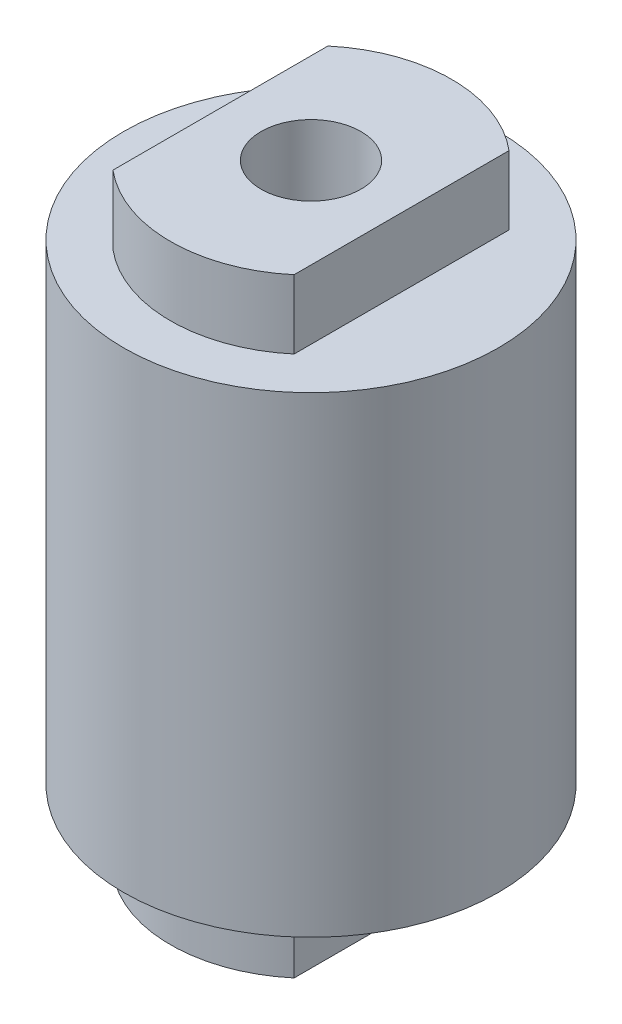
from build123d import *

# Parameters (mm, degrees)
SKETCH1_W           = 4.5
SKETCH1_H           = 19.5
CUT_EXTRUDE1_DEPTH  = 2.2
SKETCH5_R           = 1.6
CUT_EXTRUDE2_DEPTH  = 21.512191497
CUT_EXTRUDE3_START  = -7
CUT_EXTRUDE3_DEPTH  = 2.65
BOSS_EXTRUDE1_START = -2.2
SKETCH2_3_R         = 6
SKETCH2_3_R_2       = 4.5
BOSS_EXTRUDE1_DEPTH = 15.1


with BuildPart() as part:
    # Sketch1 → Revolve1 (revolve)
    with BuildSketch(Plane.XY, mode=Mode.PRIVATE) as revolve1_sk:
        with Locations((2.25, 0)):
            Rectangle(SKETCH1_W, SKETCH1_H)
    revolve(revolve1_sk.sketch.rotate(Axis((0, 9.75, 0), (0, -1, 0)), 180), axis=Axis((0, 9.75, 0), (0, -1, 0)))

    # Sketch2 → Cut-Extrude1 (cut)
    with BuildSketch(Plane(origin=(0, 9.75, 0), x_dir=(1, 0, 0), z_dir=(0, 1, 0))):
        with BuildLine():
            Line((-2.9, -3.440930107), (-2.9, 3.440930107))
            ThreePointArc((-2.9, 3.440930107), (-4.5, 0), (-2.9, -3.440930107))
        make_face()
        with BuildLine():
            ThreePointArc((4.5, 0), (4.080441153, 1.897366596), (2.9, 3.440930107))
            Line((2.9, 3.440930107), (2.9, -3.440930107))
            ThreePointArc((2.9, -3.440930107), (4.080441153, -1.897366596), (4.5, 0))
        make_face()
    cut_extrude1 = extrude(amount=-CUT_EXTRUDE1_DEPTH, mode=Mode.SUBTRACT)

    # Sketch5 → Cut-Extrude2 (cut, through all)
    with BuildSketch(Plane(origin=(0, 9.75, 0), x_dir=(1, 0, 0), z_dir=(0, 1, 0))):
        with Locations(Location((0, 0, 0), (0, 0, 180))):
            Circle(SKETCH5_R)
    cut_extrude2 = extrude(amount=-CUT_EXTRUDE2_DEPTH, mode=Mode.SUBTRACT)

    # Sketch6 → Cut-Extrude3 (cut)
    with BuildSketch(Plane(origin=(0, 9.75, 0), x_dir=(1, 0, 0), z_dir=(0, 1, 0)).offset(CUT_EXTRUDE3_START)):
        Polygon((3.406366588, 0), (1.703183294, 2.95), (-1.703183294, 2.95), (-1.703183294, -2.95), (1.703183294, -2.95), align=None)
        Polygon((-1.703183294, -2.95), (-1.703183294, 2.95), (-3.406366588, 0), align=None)
    cut_extrude3 = extrude(amount=CUT_EXTRUDE3_DEPTH, mode=Mode.SUBTRACT)

    # Mirror2: Cut-Extrude1, Cut-Extrude2, Cut-Extrude3 across plane
    add(cut_extrude1.mirror(Plane.ZX), mode=Mode.SUBTRACT)
    add(cut_extrude2.mirror(Plane.ZX), mode=Mode.SUBTRACT)
    add(cut_extrude3.mirror(Plane.ZX), mode=Mode.SUBTRACT)

    # Sketch2<3> → Boss-Extrude1 (add)
    with BuildSketch(Plane(origin=(0, 9.75, 0), x_dir=(1, 0, 0), z_dir=(0, 1, 0)).offset(BOSS_EXTRUDE1_START)):
        with Locations(Location((0, 0, 0), (0, 0, 180))):
            Circle(SKETCH2_3_R)
        Circle(SKETCH2_3_R_2, mode=Mode.SUBTRACT)
    extrude(amount=-BOSS_EXTRUDE1_DEPTH)


solid = part.part
